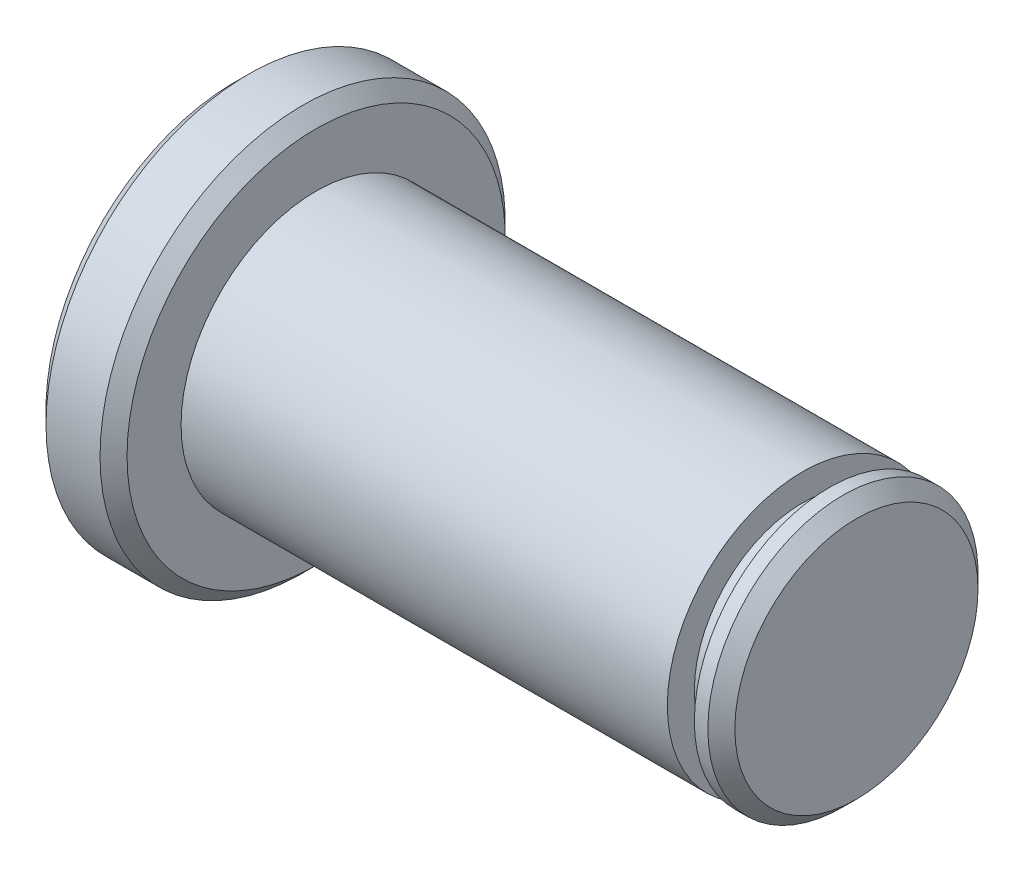
from build123d import *

# Parameters (mm, degrees)
CHAMFER_1_SIZE = 0.5


with BuildPart() as part:
    # 草图1 → 旋转1 (revolve)
    with BuildSketch(Plane.XY, mode=Mode.PRIVATE) as revolve_1_sk:
        Polygon((-6.231884058, 0), (-6.231884058, 7.5), (-3.231884058, 7.5), (-3.231884058, 5), (14.768115942, 5), (14.768115942, 4), (15.768115942, 4), (15.768115942, 5), (16.768115942, 5), (16.768115942, 0), align=None)
    revolve(revolve_1_sk.sketch.rotate(Axis((-11.630434783, 0, 0), (1, 0, 0)), 90), axis=Axis((-11.630434783, 0, 0), (1, 0, 0)))

    # 倒角1
    chamfer_1_edges = [part.edges().sort_by_distance(p)[0] for p in [
        (-3.231884058, 0, -7.5),
        (-6.231884058, 0, -7.5),
        (16.768115942, 0, -5),
    ]]
    chamfer(chamfer_1_edges, length=CHAMFER_1_SIZE)


solid = part.part
